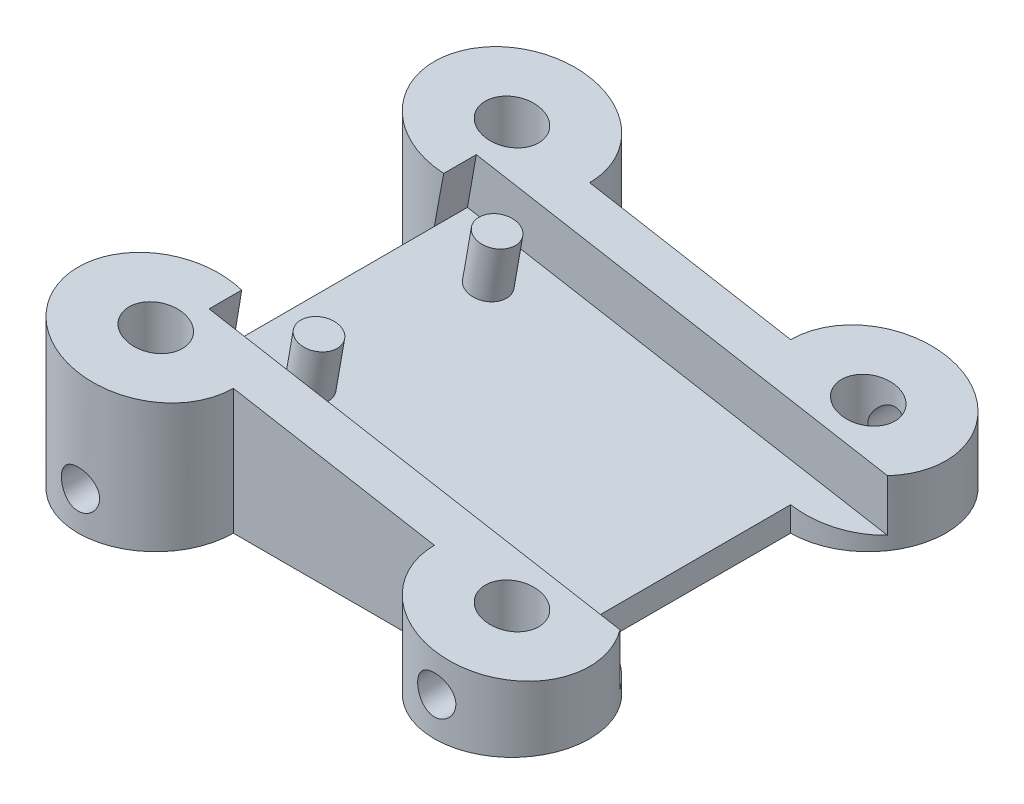
from build123d import *

# Parameters (mm, degrees)
SKETCH1_W           = 28
SKETCH1_H           = 28
BOSS_EXTRUDE1_DEPTH = 10.93715546
CUT_EXTRUDE1_DEPTH  = 42.080669049
SKETCH3_W           = 50
SKETCH3_H           = 21
CUT_EXTRUDE2_DEPTH  = 4
SKETCH11_R          = 1.45
BOSS_EXTRUDE2_DEPTH = 4
SKETCH13_R          = 2.1
CUT_EXTRUDE5_DEPTH  = 42.080669049
BOSS_EXTRUDE3_REACH = 43.081
SKETCH14_R          = 6.1
SKETCH14_R_2        = 2.1
SKETCH15_R          = 1.5
CUT_EXTRUDE6_DEPTH  = 50.698351719
SKETCH16_R          = 1.5
CUT_EXTRUDE7_DEPTH  = 50.69835188
SKETCH18_W          = 30
SKETCH18_H          = 21
CUT_EXTRUDE8_DEPTH  = 4


with BuildPart() as part:
    # Sketch1 → Boss-Extrude1 (new body)
    with BuildSketch(Plane(origin=(0, 0, 0), x_dir=(1, 0, 0), z_dir=(0, 1, 0))):
        with Locations((14, 14)):
            Rectangle(SKETCH1_W, SKETCH1_H)
    extrude(amount=BOSS_EXTRUDE1_DEPTH)

    # Sketch2 → Cut-Extrude1 (cut, through all)
    with BuildSketch(Plane.XY):
        Polygon((0, 10.93715546), (28, 6), (28, 10.93715546), align=None)
    extrude(amount=-CUT_EXTRUDE1_DEPTH, mode=Mode.SUBTRACT)

    # Sketch3 → Cut-Extrude2 (cut)
    with BuildSketch(Plane(origin=(1.870363739, 10.607359869, 0), x_dir=(0.9848077530122081, -0.17364817766693036, 0), z_dir=(0.17364817766693036, 0.9848077530122081, 0))):
        with Locations((23.100782886, 14)):
            Rectangle(SKETCH3_W, SKETCH3_H)
    extrude(amount=-CUT_EXTRUDE2_DEPTH, mode=Mode.SUBTRACT)

    # Sketch11 → Boss-Extrude2 (add)
    with BuildSketch(Plane(origin=(1.175771028, 6.668128857, 0), x_dir=(0.9848077530122081, -0.17364817766693033, 0), z_dir=(0.1736481776669303, 0.984807753012208, 0))):
        with Locations((4.022063375, 21)):
            Circle(SKETCH11_R)
        with Locations((4.022063375, 7)):
            Circle(SKETCH11_R)
    extrude(amount=BOSS_EXTRUDE2_DEPTH)

    # Sketch13 → Cut-Extrude5 (cut, through all)
    with BuildSketch(Plane.XZ):
        Circle(SKETCH13_R)
        with Locations((28, 0)):
            Circle(SKETCH13_R)
        with Locations((28, -28)):
            Circle(SKETCH13_R)
        with Locations((0, -28)):
            Circle(SKETCH13_R)
    extrude(amount=-CUT_EXTRUDE5_DEPTH, mode=Mode.SUBTRACT)

    # Boss-Extrude3: up to this plane
    boss_extrude3_end = Plane(origin=(0, 10.93715546, -28), z_dir=(-0.17364817766693036, -0.9848077530122081, 0))
    # Sketch14 → Boss-Extrude3 (add, up to the surface)
    with BuildSketch(Plane.XZ, mode=Mode.PRIVATE) as boss_extrude3_sk1:
        Circle(SKETCH14_R)
        with Locations(Location((0, 0, 0), (0, 0, 270))):
            Circle(SKETCH14_R_2, mode=Mode.SUBTRACT)
    boss_extrude3_tool1 = split(extrude(boss_extrude3_sk1.sketch, amount=-BOSS_EXTRUDE3_REACH, mode=Mode.PRIVATE), bisect_by=boss_extrude3_end, keep=Keep.BOTH, mode=Mode.PRIVATE)
    add(boss_extrude3_tool1.solids().sort_by_distance((-5.927466, 0, 0))[0])
    # Sketch14 → Boss-Extrude3 (add, up to the surface)
    with BuildSketch(Plane.XZ, mode=Mode.PRIVATE) as boss_extrude3_sk2:
        with Locations((28, 0)):
            Circle(SKETCH14_R)
        with Locations(Location((28, 0, 0), (0, 0, 270))):
            Circle(SKETCH14_R_2, mode=Mode.SUBTRACT)
    boss_extrude3_tool2 = split(extrude(boss_extrude3_sk2.sketch, amount=-BOSS_EXTRUDE3_REACH, mode=Mode.PRIVATE), bisect_by=boss_extrude3_end, keep=Keep.BOTH, mode=Mode.PRIVATE)
    add(boss_extrude3_tool2.solids().sort_by_distance((22.072534, 0, 0))[0])
    # Sketch14 → Boss-Extrude3 (add, up to the surface)
    with BuildSketch(Plane.XZ, mode=Mode.PRIVATE) as boss_extrude3_sk3:
        with Locations((28, -28)):
            Circle(SKETCH14_R)
        with Locations(Location((28, -28, 0), (0, 0, 270))):
            Circle(SKETCH14_R_2, mode=Mode.SUBTRACT)
    boss_extrude3_tool3 = split(extrude(boss_extrude3_sk3.sketch, amount=-BOSS_EXTRUDE3_REACH, mode=Mode.PRIVATE), bisect_by=boss_extrude3_end, keep=Keep.BOTH, mode=Mode.PRIVATE)
    add(boss_extrude3_tool3.solids().sort_by_distance((22.072534, 0, -28))[0])
    # Sketch14 → Boss-Extrude3 (add, up to the surface)
    with BuildSketch(Plane.XZ, mode=Mode.PRIVATE) as boss_extrude3_sk4:
        with Locations((0, -28)):
            Circle(SKETCH14_R)
        with Locations(Location((0, -28, 0), (0, 0, 270))):
            Circle(SKETCH14_R_2, mode=Mode.SUBTRACT)
    boss_extrude3_tool4 = split(extrude(boss_extrude3_sk4.sketch, amount=-BOSS_EXTRUDE3_REACH, mode=Mode.PRIVATE), bisect_by=boss_extrude3_end, keep=Keep.BOTH, mode=Mode.PRIVATE)
    add(boss_extrude3_tool4.solids().sort_by_distance((-5.927466, 0, -28))[0])

    # Sketch15 → Cut-Extrude6 (cut, through all)
    with BuildSketch(Plane(origin=(0, 0, -28), x_dir=(-1, 0, 0), z_dir=(0, 0, -1))):
        with Locations(Location((-28, 3, 0), (0, 0, 270))):
            Circle(SKETCH15_R)
        with Locations(Location((0, 3, 0), (0, 0, 90))):
            Circle(SKETCH15_R)
    extrude(amount=CUT_EXTRUDE6_DEPTH, mode=Mode.SUBTRACT)

    # Sketch16 → Cut-Extrude7 (cut, through all)
    with BuildSketch(Plane.XY):
        with Locations(Location((0, 3, 0), (0, 0, 90))):
            Circle(SKETCH16_R)
        with Locations(Location((28, 3, 0), (0, 0, 270))):
            Circle(SKETCH16_R)
    extrude(amount=CUT_EXTRUDE7_DEPTH, mode=Mode.SUBTRACT)

    # Sketch18 → Cut-Extrude8 (cut)
    with BuildSketch(Plane(origin=(1.870363739, 10.607359869, 0), x_dir=(0.9848077530122081, -0.17364817766693036, 0), z_dir=(0.17364817766693036, 0.9848077530122081, 0))):
        with BuildLine():
            Line((3.879160535, 24.5), (-1.193909192, 24.5))
            Line((-1.193909192, 24.5), (-1.193909192, 21.9))
            add(Edge.make_bspline(
                [(-1.193909192, 21.9), (2.029603864, 21.9), (3.879160535, 24.5)],
                knots=[4.71238898, 4.71238898, 4.71238898, 5.672083151, 5.672083151, 5.672083151], degree=2, weights=[1, 0.887065525, 1]))
        make_face()
        with Locations((21.459658291, 14)):
            Rectangle(SKETCH18_W, SKETCH18_H)
        with BuildLine():
            Line((-1.193909192, 6.1), (-1.193909192, 3.5))
            Line((-1.193909192, 3.5), (3.879160535, 3.5))
            add(Edge.make_bspline(
                [(3.879160535, 3.5), (2.029603864, 6.1), (-1.193909192, 6.1)],
                knots=[0.611102156, 0.611102156, 0.611102156, 1.570796327, 1.570796327, 1.570796327], degree=2, weights=[1, 0.887065525, 1]))
        make_face()
    extrude(amount=-CUT_EXTRUDE8_DEPTH, mode=Mode.SUBTRACT)


solid = part.part
